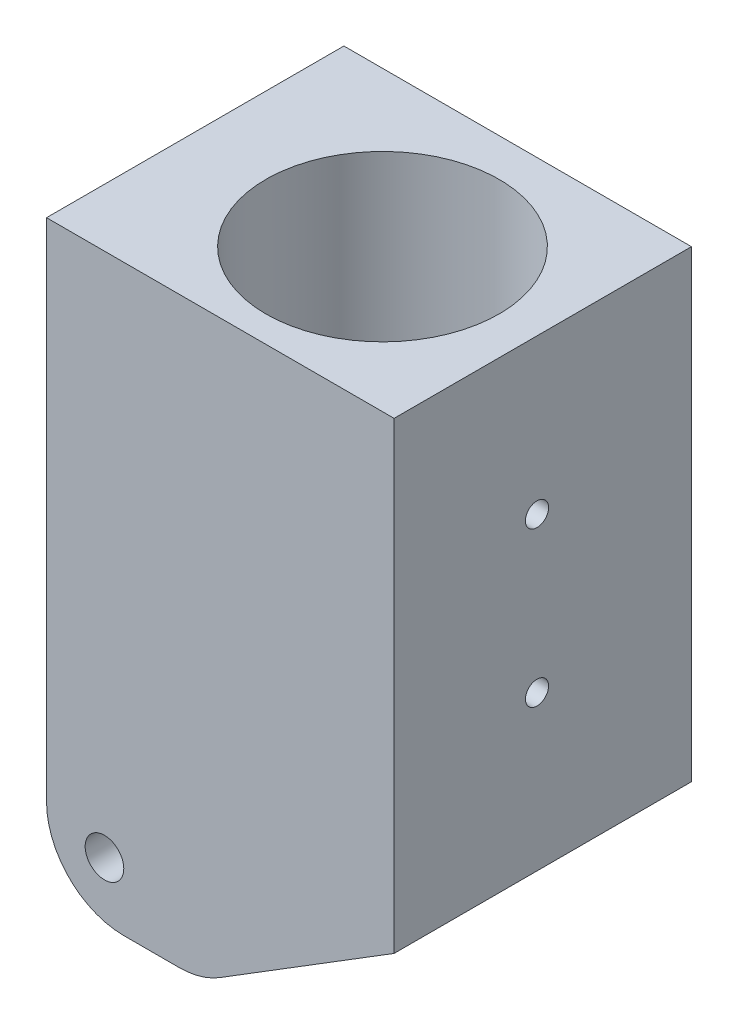
from build123d import *

# Parameters (mm, degrees)
SKETCH_1_W             = 45
SKETCH_1_H             = 38.5
EXTRUDE_1_DEPTH        = 60
SKETCH_2_R             = 15.1
CUT_EXTRUDE_1_DEPTH    = 50
SKETCH_3_R             = 2.5
EXTRUDE_2_DEPTH        = 5
SKETCH_4_R             = 1.5
CUT_EXTRUDE_2_DEPTH    = 78.620873481
PATTERN_LINEAR_1_COUNT = 2
PATTERN_LINEAR_1_PITCH = 20
FILLET_1_R             = 10


with BuildPart() as part:
    # 草圖1 → 填料-伸長1 (new body)
    with BuildSketch(Plane(origin=(0, 0, 0), x_dir=(1, 0, 0), z_dir=(0, 1, 0))):
        with Locations((-2.5, 0.75)):
            Rectangle(SKETCH_1_W, SKETCH_1_H)
    extrude(amount=EXTRUDE_1_DEPTH)

    # 草圖2 → 除料-伸長1 (cut)
    with BuildSketch(Plane(origin=(0, 60, 0), x_dir=(1, 0, 0), z_dir=(0, 1, 0))):
        with Locations(Location((0, 0, 0), (0, 0, 270))):
            Circle(SKETCH_2_R)
    extrude(amount=-CUT_EXTRUDE_1_DEPTH, mode=Mode.SUBTRACT)

    # 草圖3 → 填料-伸長2 (add)
    with BuildSketch(Plane.XY.offset(18.5)):
        Polygon((-25, 0), (-25, -15.5), (-5, -15.5), (20, 0), align=None)
        with Locations((-17.5, -8)):
            Circle(SKETCH_3_R, mode=Mode.SUBTRACT)
    extrude(amount=-EXTRUDE_2_DEPTH)

    # 草圖4 → 除料-伸長2 (cut, through all)
    with BuildSketch(Plane(origin=(20, 0, 0), x_dir=(0, 0, -1), z_dir=(1, 0, 0))):
        with Locations((0, 20)):
            Circle(SKETCH_4_R)
    cut_extrude_2 = extrude(amount=-CUT_EXTRUDE_2_DEPTH, mode=Mode.SUBTRACT)

    # 直線複製排列1: 除料-伸長2 ×2
    with Locations(*[(0, i * PATTERN_LINEAR_1_PITCH, 0) for i in range(1, PATTERN_LINEAR_1_COUNT)]):
        add(cut_extrude_2, mode=Mode.SUBTRACT)

    # 圓角1
    fillet_1_edges = [part.edges().sort_by_distance(p)[0] for p in [
        (-5, -15.5, 16),
        (-25, -15.5, 16),
    ]]
    fillet(fillet_1_edges, radius=FILLET_1_R)


solid = part.part
